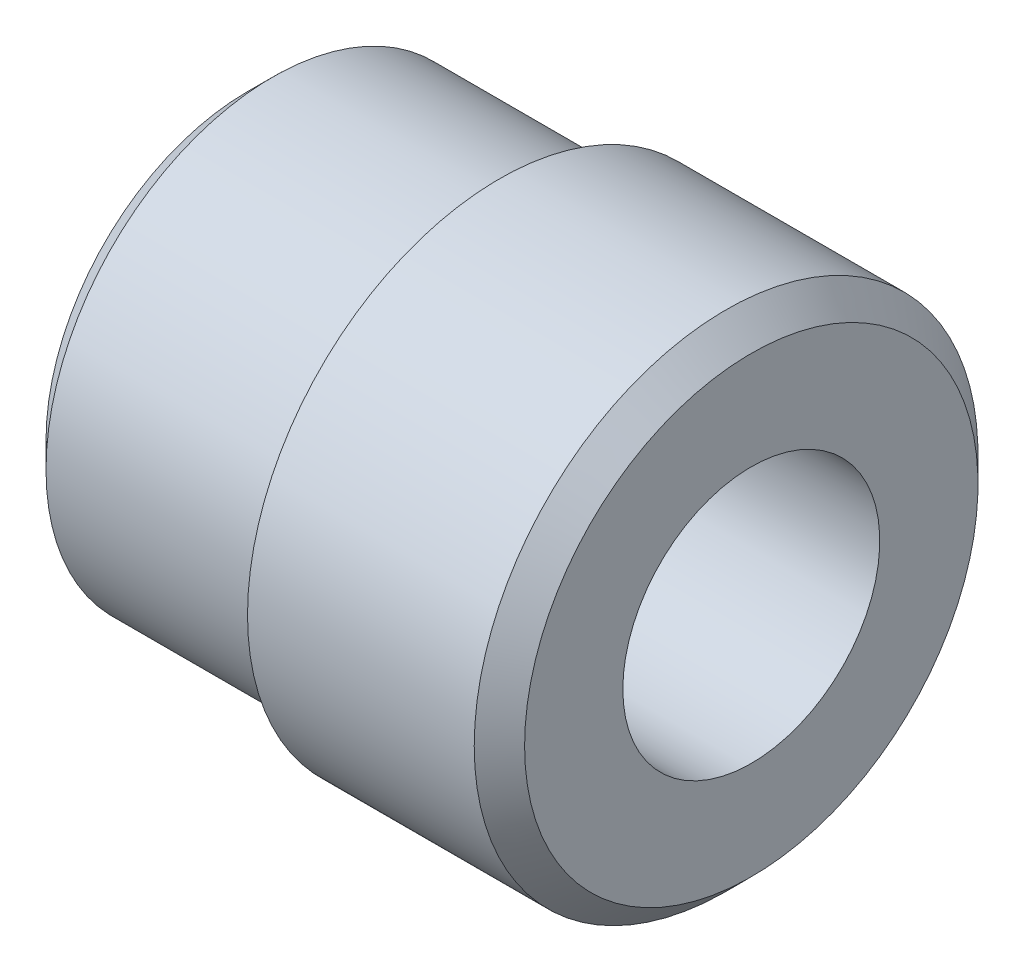
from build123d import *

# Parameters (mm, degrees)
HOLE_WIZARD_M121_D = 10.2
CHAMFER_1_SIZE     = 1


with BuildPart() as part:
    # Эскиз1 → Повернуть1 (revolve)
    with BuildSketch(Plane.XY, mode=Mode.PRIVATE) as revolve_1_sk:
        Polygon((0, 5), (0, 9), (10, 9), (10, 10), (20, 10), (20, 5), align=None)
    revolve(revolve_1_sk.sketch.rotate(Axis((0, 0, 0), (1, 0, 0)), 90), axis=Axis((0, 0, 0), (1, 0, 0)))

    # Отверстие обработанное метчиком M121 (through all)
    with Locations(Plane.ZY):
        with Locations((0, 0)):
            Hole(HOLE_WIZARD_M121_D / 2)

    # Фаска1
    chamfer_1_edges = [part.edges().sort_by_distance(p)[0] for p in [
        (20, 0, -10),
        (0, 0, -9),
    ]]
    chamfer(chamfer_1_edges, length=CHAMFER_1_SIZE)


solid = part.part
